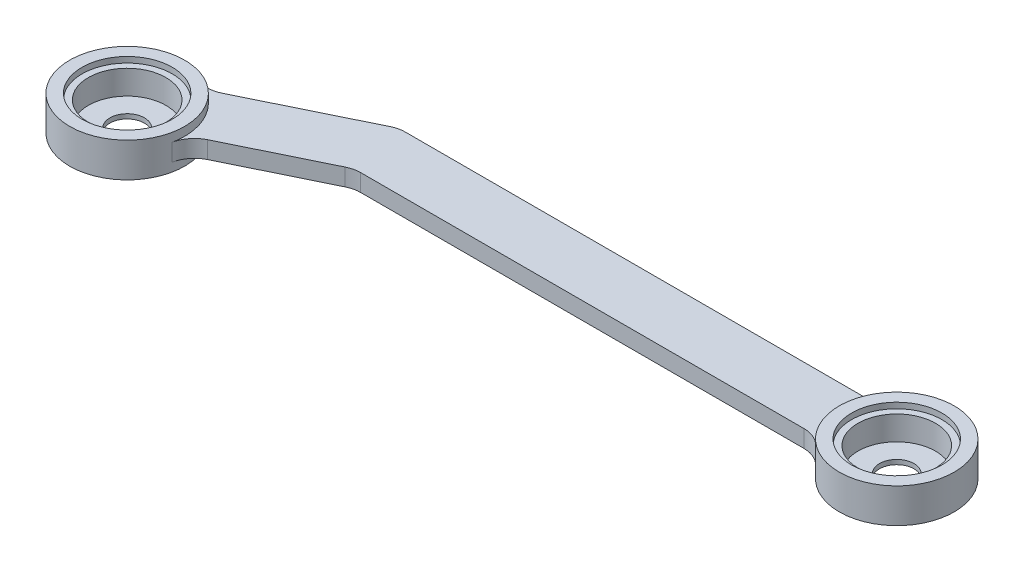
from build123d import *
from build123d.topology import SkipClean

# Parameters (mm, degrees)
SKETCH1_R           = 7.85
SKETCH1_R_2         = 3
BOSS_EXTRUDE1_DEPTH = 3
BOSS_EXTRUDE2_START = -6
BOSS_EXTRUDE2_DEPTH = 6
CUT_EXTRUDE1_DEPTH  = 1.5
CUT_EXTRUDE3_START  = -1.5
CUT_EXTRUDE3_DEPTH  = 1.5
SKETCH6_R           = 7.85
CUT_EXTRUDE4_DEPTH  = 1
SKETCH7_R           = 6.75
CUT_EXTRUDE5_DEPTH  = 4.2


with BuildPart() as part:
    # Sketch1 → Boss-Extrude1 (new, symmetric)
    # profile 1 of 7: a face of its own
    with BuildSketch(Plane(origin=(0, 0, 0), x_dir=(1, 0, 0), z_dir=(0, 1, 0))):
        with BuildLine():
            Line((10, 0), (7.85, 0))
            ThreePointArc((7.85, 0), (0, -7.85), (-7.85, 0))
            Line((-7.85, 0), (-101.897208147, 0))
            Line((-101.897208147, 0), (-112.298830122, -5.073262344))
            ThreePointArc((-112.298830122, -5.073262344), (-114.133881847, -5.566552555), (-116.020469414, -5.339534014))
            ThreePointArc((-116.020469414, -5.339534014), (-127.076790304, -20.864277212), (-109.083980094, -14.577890036))
            Line((-109.083980094, -14.577890036), (-90.484120267, -5.506038677))
            ThreePointArc((-90.484120267, -5.506038677), (-89.41701144, -5.128151962), (-88.292246268, -5))
            Line((-88.292246268, -5), (-11.180339887, -5))
            ThreePointArc((-11.180339887, -5), (-9.139098435, -5.435645354), (-7.453559925, -6.666666667))
            ThreePointArc((-7.453559925, -6.666666667), (3.568220898, -9.34172359), (10, 0))
        make_face()
        with Locations((-119.08, -14.86)):
            Circle(SKETCH1_R, mode=Mode.SUBTRACT)
    # profile 2 of 7: a face of its own
    with BuildSketch(Plane(origin=(0, 0, 0), x_dir=(1, 0, 0), z_dir=(0, 1, 0))):
        with Locations((-119.08, -14.86)):
            Circle(SKETCH1_R)
        with Locations(Location((-119.08, -14.86, 0), (0, 0, 270))):
            Circle(SKETCH1_R_2, mode=Mode.SUBTRACT)
    # profile 3 of 7: a face of its own
    with BuildSketch(Plane(origin=(0, 0, 0), x_dir=(1, 0, 0), z_dir=(0, 1, 0))):
        with BuildLine():
            ThreePointArc((-7.85, 0), (0, 7.85), (7.85, 0))
            Line((7.85, 0), (10, 0))
            ThreePointArc((10, 0), (3.568220898, 9.34172359), (-7.453559925, 6.666666667))
            ThreePointArc((-7.453559925, 6.666666667), (-9.139098435, 5.435645354), (-11.180339887, 5))
            Line((-11.180339887, 5), (-90.491443028, 5))
            ThreePointArc((-90.491443028, 5), (-91.616208201, 4.871848038), (-92.683317027, 4.493961323))
            Line((-92.683317027, 4.493961323), (-101.897208147, 0))
            Line((-101.897208147, 0), (-7.85, 0))
        make_face()
    # profile 4 of 7: a face of its own
    with BuildSketch(Plane(origin=(0, 0, 0), x_dir=(1, 0, 0), z_dir=(0, 1, 0))):
        with BuildLine():
            ThreePointArc((-3, 0), (0, 3), (3, 0))
            Line((3, 0), (7.85, 0))
            ThreePointArc((7.85, 0), (0, 7.85), (-7.85, 0))
            Line((-7.85, 0), (-3, 0))
        make_face()
    # profile 5 of 7: a face of its own
    with BuildSketch(Plane(origin=(0, 0, 0), x_dir=(1, 0, 0), z_dir=(0, 1, 0))):
        with BuildLine():
            Line((7.85, 0), (3, 0))
            ThreePointArc((3, 0), (0, -3), (-3, 0))
            Line((-3, 0), (-7.85, 0))
            ThreePointArc((-7.85, 0), (0, -7.85), (7.85, 0))
        make_face()
    # profile 6 of 7: a face of its own
    with BuildSketch(Plane(origin=(0, 0, 0), x_dir=(1, 0, 0), z_dir=(0, 1, 0))):
        with BuildLine():
            ThreePointArc((-3, 0), (0, 3), (3, 0))
            Line((3, 0), (7.85, 0))
            ThreePointArc((7.85, 0), (0, 7.85), (-7.85, 0))
            Line((-7.85, 0), (-3, 0))
        make_face()
    # profile 7 of 7: a face of its own
    with BuildSketch(Plane(origin=(0, 0, 0), x_dir=(1, 0, 0), z_dir=(0, 1, 0))):
        with BuildLine():
            Line((7.85, 0), (3, 0))
            ThreePointArc((3, 0), (0, -3), (-3, 0))
            Line((-3, 0), (-7.85, 0))
            ThreePointArc((-7.85, 0), (0, -7.85), (7.85, 0))
        make_face()
    extrude(amount=BOSS_EXTRUDE1_DEPTH, both=True)

    # Sketch3 → Boss-Extrude2 (add)
    with BuildSketch(Plane.XZ.offset(3).offset(BOSS_EXTRUDE2_START)):
        with BuildLine():
            Line((-109.083980094, 14.577890036), (-106.572243843, 13.352821776))
            ThreePointArc((-106.572243843, 13.352821776), (-108.334212899, 14.786207157), (-109.280246563, 16.851188733))
            ThreePointArc((-109.280246563, 16.851188733), (-109.117062064, 15.720155621), (-109.083980094, 14.577890036))
        make_face()
        with BuildLine():
            Line((-109.737977242, 15.328711334), (-109.083980094, 14.577890036))
            ThreePointArc((-109.083980094, 14.577890036), (-109.117062064, 15.720155621), (-109.280246563, 16.851188733))
            Line((-109.280246563, 16.851188733), (-109.737977242, 15.328711334))
        make_face()
    extrude(amount=BOSS_EXTRUDE2_DEPTH)

    # Sketch4 → Cut-Extrude1 (cut)
    with SkipClean():  # the faces are left unmerged after this step: merging them gives an invalid solid
        with BuildSketch(Plane(origin=(0, 3, 0), x_dir=(1, 0, 0), z_dir=(0, 1, 0))):
            with BuildLine():
                ThreePointArc((-7.453559925, 6.666666667), (-9.139098435, 5.435645354), (-11.180339887, 5))
                Line((-11.180339887, 5), (-90.491443028, 5))
                ThreePointArc((-90.491443028, 5), (-91.616208201, 4.871848038), (-92.683317027, 4.493961323))
                Line((-92.683317027, 4.493961323), (-112.298830122, -5.073262344))
                ThreePointArc((-112.298830122, -5.073262344), (-114.133881847, -5.566552555), (-116.020469414, -5.339534014))
                ThreePointArc((-116.020469414, -5.339534014), (-111.083209696, -8.855722788), (-109.083980094, -14.577890036))
                Line((-109.083980094, -14.577890036), (-106.572243843, -13.352821776))
                Line((-106.572243843, -13.352821776), (-90.484120267, -5.506038677))
                ThreePointArc((-90.484120267, -5.506038677), (-89.41701144, -5.128151962), (-88.292246268, -5))
                Line((-88.292246268, -5), (-11.180339887, -5))
                ThreePointArc((-11.180339887, -5), (-9.139098435, -5.435645354), (-7.453559925, -6.666666667))
                ThreePointArc((-7.453559925, -6.666666667), (-10, 0), (-7.453559925, 6.666666667))
            make_face()
            with BuildLine():
                Line((-106.572243843, -13.352821776), (-109.083980094, -14.577890036))
                ThreePointArc((-109.083980094, -14.577890036), (-109.080995073, -14.718930981), (-109.08, -14.86))
                ThreePointArc((-109.08, -14.86), (-109.13018758, -15.860616217), (-109.280246563, -16.851188733))
                ThreePointArc((-109.280246563, -16.851188733), (-108.334212899, -14.786207157), (-106.572243843, -13.352821776))
            make_face()
        extrude(amount=-CUT_EXTRUDE1_DEPTH, mode=Mode.SUBTRACT)

    # Sketch5 → Cut-Extrude3 (cut)
    with SkipClean():  # the faces are left unmerged after this step: merging them gives an invalid solid
        with BuildSketch(Plane.XZ.offset(3).offset(CUT_EXTRUDE3_START)):
            with BuildLine():
                ThreePointArc((-106.572243843, 13.352821776), (-108.334212899, 14.786207157), (-109.280246563, 16.851188733))
                ThreePointArc((-109.280246563, 16.851188733), (-109.13018758, 15.860616217), (-109.08, 14.86))
                ThreePointArc((-109.08, 14.86), (-109.080995073, 14.718930981), (-109.083980094, 14.577890036))
                Line((-109.083980094, 14.577890036), (-106.572243843, 13.352821776))
            make_face()
            with BuildLine():
                Line((-90.491443028, -5), (-11.180339887, -5))
                ThreePointArc((-11.180339887, -5), (-9.139098435, -5.435645354), (-7.453559925, -6.666666667))
                ThreePointArc((-7.453559925, -6.666666667), (-10, 0), (-7.453559925, 6.666666667))
                ThreePointArc((-7.453559925, 6.666666667), (-9.139098435, 5.435645354), (-11.180339887, 5))
                Line((-11.180339887, 5), (-88.292246268, 5))
                ThreePointArc((-88.292246268, 5), (-89.41701144, 5.128151962), (-90.484120267, 5.506038677))
                Line((-90.484120267, 5.506038677), (-106.572243843, 13.352821776))
                Line((-106.572243843, 13.352821776), (-109.083980094, 14.577890036))
                ThreePointArc((-109.083980094, 14.577890036), (-111.083209696, 8.855722788), (-116.020469414, 5.339534014))
                ThreePointArc((-116.020469414, 5.339534014), (-114.133881847, 5.566552555), (-112.298830122, 5.073262344))
                Line((-112.298830122, 5.073262344), (-92.683317027, -4.493961323))
                ThreePointArc((-92.683317027, -4.493961323), (-91.616208201, -4.871848038), (-90.491443028, -5))
            make_face()
        extrude(amount=CUT_EXTRUDE3_DEPTH, mode=Mode.SUBTRACT)

    # Sketch6 → Cut-Extrude4 (cut)
    with SkipClean():  # the faces are left unmerged after this step: merging them gives an invalid solid
        with BuildSketch(Plane(origin=(0, 3, 0), x_dir=(1, 0, 0), z_dir=(0, 1, 0))):
            with Locations(Location((-119.08, -14.86, 0), (0, 0, 270))):
                Circle(SKETCH6_R)
            with Locations(Location((0, 0, 0), (0, 0, 270))):
                Circle(SKETCH6_R)
        extrude(amount=-CUT_EXTRUDE4_DEPTH, mode=Mode.SUBTRACT)

    # Sketch7 → Cut-Extrude5 (cut)
    with SkipClean():  # the faces are left unmerged after this step: merging them gives an invalid solid
        with BuildSketch(Plane(origin=(0, 2, 0), x_dir=(1, 0, 0), z_dir=(0, 1, 0))):
            with Locations(Location((-119.08, -14.86, 0), (0, 0, 270))):
                Circle(SKETCH7_R)
            with Locations(Location((0, 0, 0), (0, 0, 270))):
                Circle(SKETCH7_R)
        extrude(amount=-CUT_EXTRUDE5_DEPTH, mode=Mode.SUBTRACT)


solid = part.part
